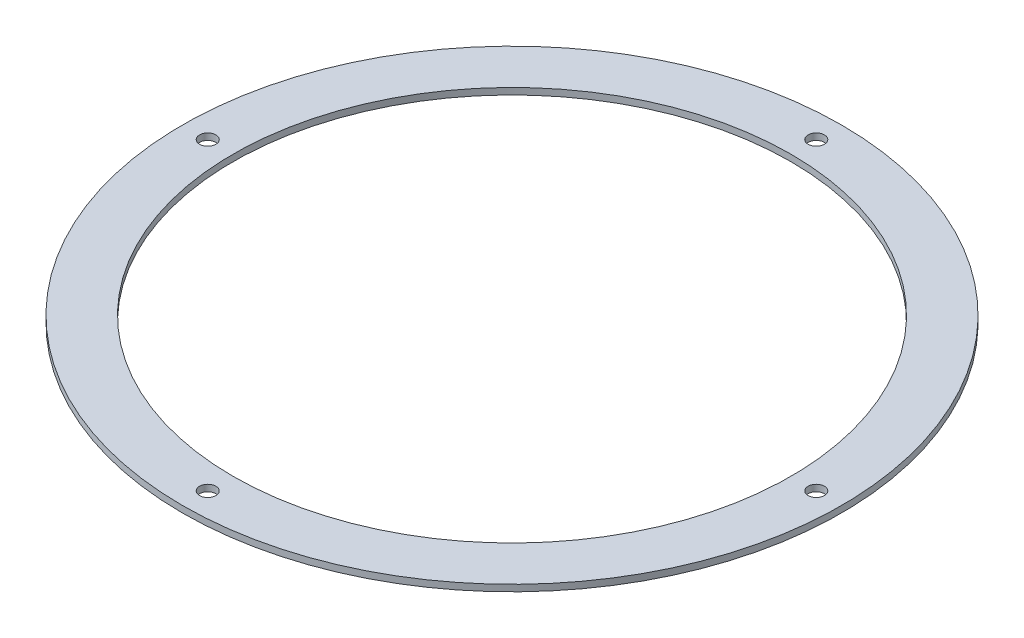
from build123d import *

# Parameters (mm, degrees)
SKETCH_1_R      = 101
SKETCH_1_R_2    = 85.5
SKETCH_1_R_3    = 2.5
EXTRUDE_2_DEPTH = 2


with BuildPart() as part:
    # 草图1 → 凸台-拉伸2 (new body)
    with BuildSketch(Plane(origin=(0, 0, 0), x_dir=(1, 0, 0), z_dir=(0, 1, 0))):
        with Locations(Location((0, 0, 0), (0, 0, 270))):
            Circle(SKETCH_1_R)
        with Locations(Location((0, 0, 0), (0, 0, 270))):
            Circle(SKETCH_1_R_2, mode=Mode.SUBTRACT)
        with Locations(Location((0, 93.25, 0), (0, 0, 270))):
            Circle(SKETCH_1_R_3, mode=Mode.SUBTRACT)
        with Locations(Location((93.25, 0, 0), (0, 0, 270))):
            Circle(SKETCH_1_R_3, mode=Mode.SUBTRACT)
        with Locations(Location((0, -93.25, 0), (0, 0, 270))):
            Circle(SKETCH_1_R_3, mode=Mode.SUBTRACT)
        with Locations(Location((-93.25, 0, 0), (0, 0, 270))):
            Circle(SKETCH_1_R_3, mode=Mode.SUBTRACT)
    extrude(amount=EXTRUDE_2_DEPTH)


solid = part.part
